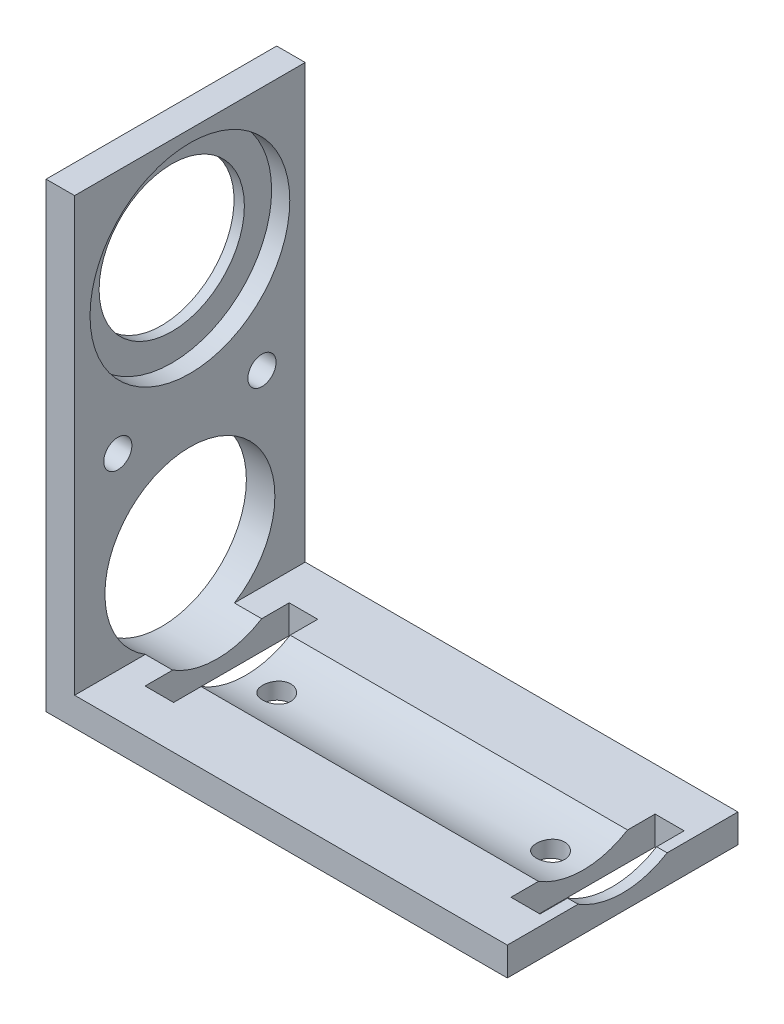
from build123d import *

# Parameters (mm, degrees)
EXTRUDE1_DEPTH     = 25.4
SKETCH2_R          = 9.36
SKETCH2_R_2        = 8
SKETCH2_R_3        = 1.55
CUT_EXTRUDE1_DEPTH = 77.2
SKETCH3_R          = 11
CUT_EXTRUDE2_DEPTH = 2
SKETCH4_R          = 1.55
SKETCH4_W          = 3.14
SKETCH4_H          = 15.875
SKETCH4_W_2        = 3.2
CUT_EXTRUDE3_DEPTH = 77.2


with BuildPart() as part:
    # Sketch1 → Extrude1 (new body)
    with BuildSketch(Plane.XY):
        Polygon((0, 0), (50.8, 0), (50.8, 3.14), (3.14, 3.14), (3.14, 50.8), (0, 50.8), align=None)
    extrude(amount=EXTRUDE1_DEPTH)

    # Sketch2 → Cut-Extrude1 (cut, through all)
    with BuildSketch(Plane.ZY):
        with Locations((12.7, 11.1125)):
            Circle(SKETCH2_R)
        with Locations((12.7, 38.4725)):
            Circle(SKETCH2_R_2)
        with Locations((4.7625, 23.8125)):
            Circle(SKETCH2_R_3)
        with Locations((20.6375, 23.8125)):
            Circle(SKETCH2_R_3)
    extrude(amount=-CUT_EXTRUDE1_DEPTH, mode=Mode.SUBTRACT)

    # Sketch3 → Cut-Extrude2 (cut)
    with BuildSketch(Plane(origin=(3.14, 0, 0), x_dir=(0, 0, -1), z_dir=(1, 0, 0))):
        with Locations((-12.7, 38.4725)):
            Circle(SKETCH3_R)
    extrude(amount=-CUT_EXTRUDE2_DEPTH, mode=Mode.SUBTRACT)

    # Sketch4 → Cut-Extrude3 (cut, through all)
    with BuildSketch(Plane.XZ):
        with Locations(Location((12.7, 12.7, 0), (0, 0, 270))):
            Circle(SKETCH4_R)
        with Locations(Location((42.86, 12.7, 0), (0, 0, 270))):
            Circle(SKETCH4_R)
        with Locations((7.71, 12.7)):
            Rectangle(SKETCH4_W, SKETCH4_H)
        with Locations((48.04, 12.7)):
            Rectangle(SKETCH4_W_2, SKETCH4_H)
    extrude(amount=-CUT_EXTRUDE3_DEPTH, mode=Mode.SUBTRACT)


solid = part.part
